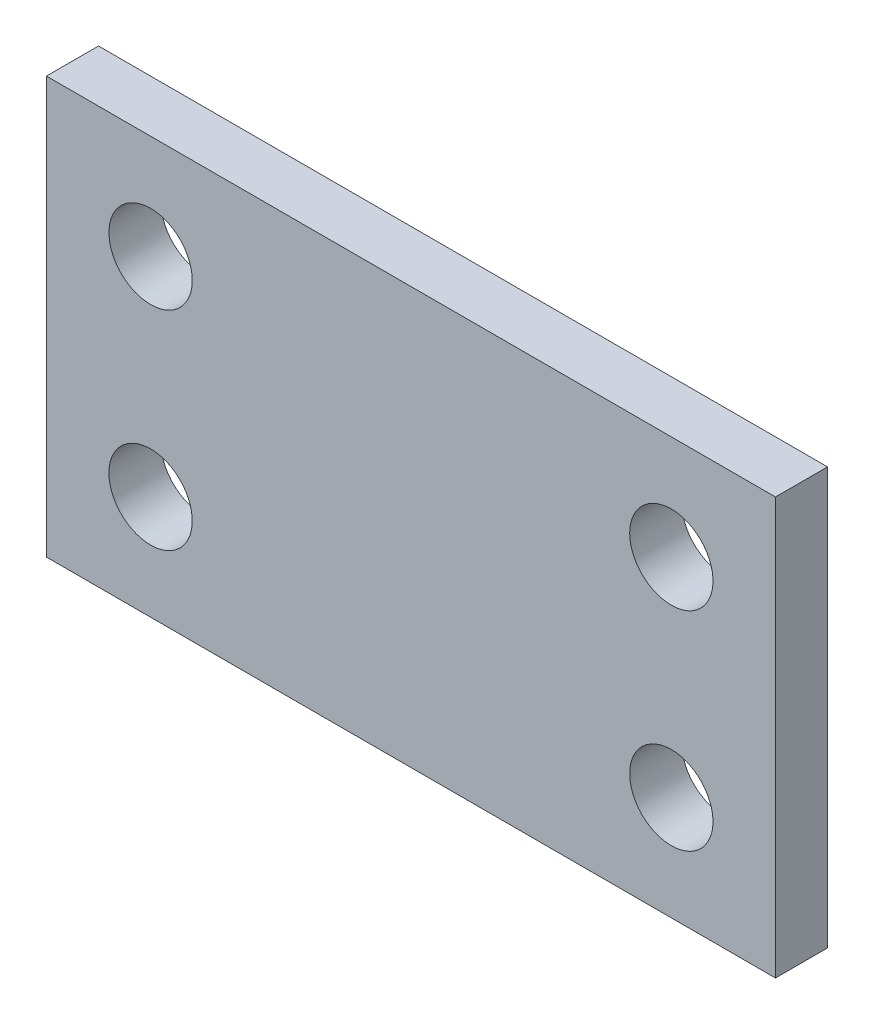
from build123d import *

# Parameters (mm, degrees)
SZKIC1_W                    = 140
SZKIC1_H                    = 80
SZKIC1_R                    = 8
DODANIE_WYCI_GNI_CIE1_DEPTH = 10


with BuildPart() as part:
    # Szkic1 → Dodanie-wyciągnięcie1 (new body)
    with BuildSketch(Plane.XY):
        Rectangle(SZKIC1_W, SZKIC1_H)
        with Locations((-50, 20)):
            Circle(SZKIC1_R, mode=Mode.SUBTRACT)
        with Locations(Location((50, 20, 0), (0, 0, 180))):
            Circle(SZKIC1_R, mode=Mode.SUBTRACT)
        with Locations((50, -20)):
            Circle(SZKIC1_R, mode=Mode.SUBTRACT)
        with Locations(Location((-50, -20, 0), (0, 0, 180))):
            Circle(SZKIC1_R, mode=Mode.SUBTRACT)
    extrude(amount=DODANIE_WYCI_GNI_CIE1_DEPTH)


solid = part.part
